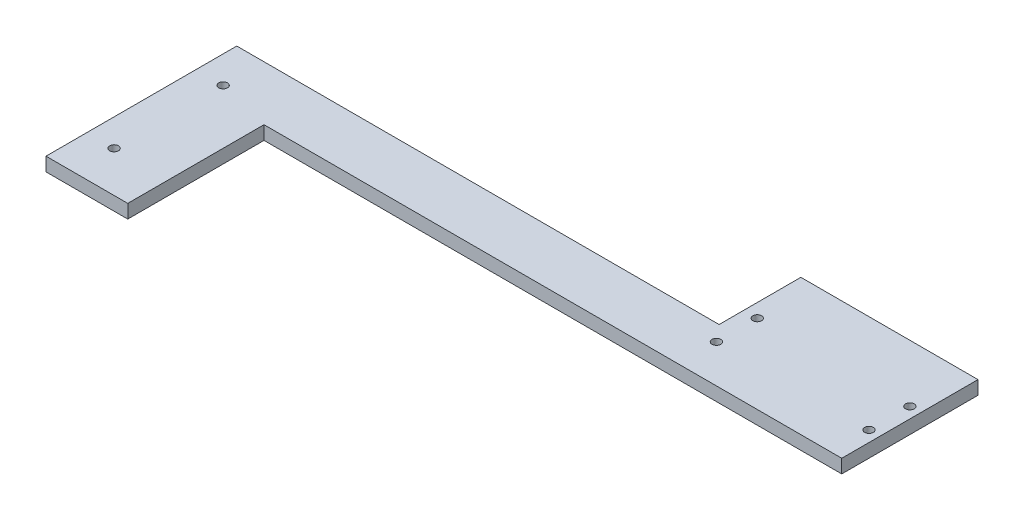
from build123d import *

# Parameters (mm, degrees)
SKETCH_1_R      = 1.6
EXTRUDE_1_DEPTH = 5


with BuildPart() as part:
    # 草图1 → 凸台-拉伸1 (new body)
    with BuildSketch(Plane(origin=(0, 0, 0), x_dir=(1, 0, 0), z_dir=(0, 1, 0))):
        Polygon((-10, 35), (0, 35), (167, 35), (167, 65), (232, 65), (232, 15), (20, 15), (20, 0), (20, -35), (0, -35), (-10, -35), align=None)
        with Locations(Location((0, -20, 0), (0, 0, 270))):
            Circle(SKETCH_1_R, mode=Mode.SUBTRACT)
        with Locations(Location((0, 20, 0), (0, 0, 90))):
            Circle(SKETCH_1_R, mode=Mode.SUBTRACT)
        with Locations(Location((172, 29, 0), (0, 0, 270))):
            Circle(SKETCH_1_R, mode=Mode.SUBTRACT)
        with Locations(Location((172, 44, 0), (0, 0, 270))):
            Circle(SKETCH_1_R, mode=Mode.SUBTRACT)
        with Locations(Location((228, 29, 0), (0, 0, 270))):
            Circle(SKETCH_1_R, mode=Mode.SUBTRACT)
        with Locations(Location((228, 44, 0), (0, 0, 270))):
            Circle(SKETCH_1_R, mode=Mode.SUBTRACT)
    extrude(amount=EXTRUDE_1_DEPTH)


solid = part.part
